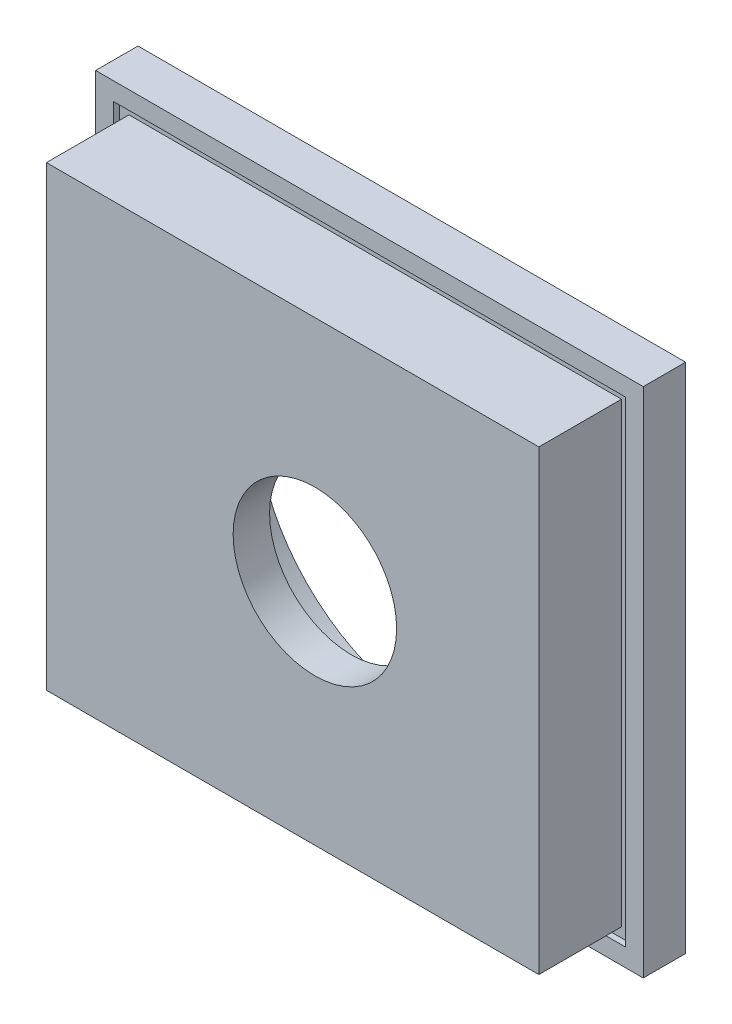
from build123d import *

# Parameters (mm, degrees)
SKETCH1_W                 = 278
SKETCH1_H                 = 260
BOSS_EXTRUDE1_DEPTH       = 60.5
SKETCH2_R                 = 90.5
CUT_EXTRUDE2_DEPTH        = 42
SKETCH3_R                 = 41.5
CUT_EXTRUDE3_DEPTH        = 386.414387381
SKETCH4_R                 = 99.95
SKETCH4_R_2               = 95.05
CUT_EXTRUDE5_DEPTH        = 2.95
SKETCH6_W                 = 278
SKETCH6_H                 = 260
SKETCH6_W_2               = 250
SKETCH6_H_2               = 232
CUT_EXTRUDE6_DEPTH        = 39
SKETCH7_W                 = 259.8
SKETCH7_H                 = 241.8
SKETCH7_W_2               = 250
SKETCH7_H_2               = 232
CUT_EXTRUDE7_DEPTH        = 41.95
F_8_0MM_DOWEL_HOLE1_D     = 8
F_8_0MM_DOWEL_HOLE1_DEPTH = 15
F_8_0MM_DOWEL_HOLE1_TIP   = 2.403442476
SKETCH10_R                = 3
CUT_EXTRUDE8_DEPTH        = 46


with BuildPart() as part:
    # Sketch1 → Boss-Extrude1 (new body)
    with BuildSketch(Plane.XY):
        with Locations((139, 130)):
            Rectangle(SKETCH1_W, SKETCH1_H)
    extrude(amount=BOSS_EXTRUDE1_DEPTH)

    # Sketch2 → Cut-Extrude2 (cut)
    with BuildSketch(Plane.XY):
        with Locations(Location((150.3, 130, 0), (0, 0, 180))):
            Circle(SKETCH2_R)
    extrude(amount=CUT_EXTRUDE2_DEPTH, mode=Mode.SUBTRACT)

    # Sketch3 → Cut-Extrude3 (cut, through all)
    with BuildSketch(Plane.XY):
        with Locations((150.3, 130)):
            Circle(SKETCH3_R)
    extrude(amount=CUT_EXTRUDE3_DEPTH, mode=Mode.SUBTRACT)

    # Sketch4 → Cut-Extrude5 (cut)
    with BuildSketch(Plane.XY):
        with Locations((150.3, 130)):
            Circle(SKETCH4_R)
        with Locations((150.3, 130)):
            Circle(SKETCH4_R_2, mode=Mode.SUBTRACT)
    extrude(amount=CUT_EXTRUDE5_DEPTH, mode=Mode.SUBTRACT)

    # Sketch6 → Cut-Extrude6 (cut)
    with BuildSketch(Plane.XY.offset(60.5)):
        with Locations((139, 130)):
            Rectangle(SKETCH6_W, SKETCH6_H)
        with Locations((139, 130)):
            Rectangle(SKETCH6_W_2, SKETCH6_H_2, mode=Mode.SUBTRACT)
    extrude(amount=-CUT_EXTRUDE6_DEPTH, mode=Mode.SUBTRACT)

    # Sketch7 → Cut-Extrude7 (cut)
    with BuildSketch(Plane.XY.offset(60.5)):
        with Locations((139, 130)):
            Rectangle(SKETCH7_W, SKETCH7_H)
        with Locations((139, 130)):
            Rectangle(SKETCH7_W_2, SKETCH7_H_2, mode=Mode.SUBTRACT)
    extrude(amount=-CUT_EXTRUDE7_DEPTH, mode=Mode.SUBTRACT)

    # Ø8.0mm Dowel Hole1
    with Locations(Plane(origin=(0, 0, 0), x_dir=(-1, 0, 0), z_dir=(0, 0, -1))):
        with Locations((-204.05, 223.097730907), (-96.55, 223.097730907), (-42.8, 130), (-96.55, 36.902269093), (-204.05, 36.902269093), (-257.8, 130)):
            Hole(F_8_0MM_DOWEL_HOLE1_D / 2, depth=F_8_0MM_DOWEL_HOLE1_DEPTH)
            with Locations((0, 0, -(F_8_0MM_DOWEL_HOLE1_DEPTH + F_8_0MM_DOWEL_HOLE1_TIP / 2))):  # 118° drill point
                Cone(0, F_8_0MM_DOWEL_HOLE1_D / 2, F_8_0MM_DOWEL_HOLE1_TIP, mode=Mode.SUBTRACT)

    # Sketch10 → Cut-Extrude8 (cut)
    with BuildSketch(Plane(origin=(0, 0, 0), x_dir=(1, 0, 0), z_dir=(0, 1, 0))):
        with Locations(Location((150.3, -9, 0), (0, 0, 90))):
            Circle(SKETCH10_R)
    extrude(amount=CUT_EXTRUDE8_DEPTH, mode=Mode.SUBTRACT)


solid = part.part
